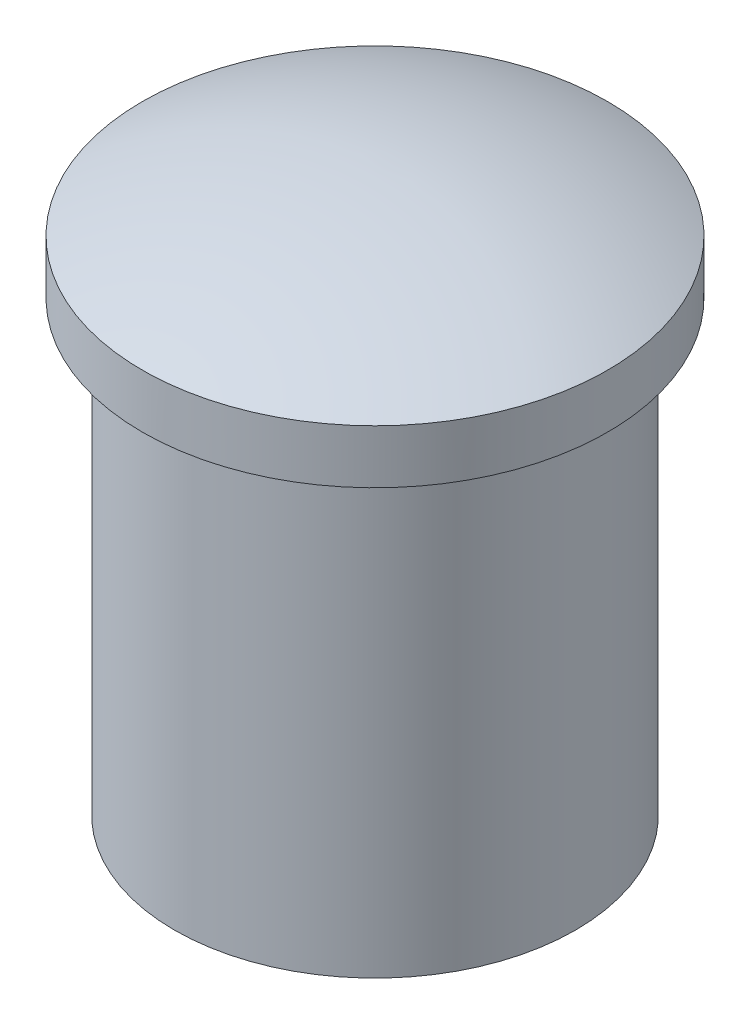
from build123d import *


with BuildPart() as part:
    # Sketch1 → Revolve1 (revolve)
    with BuildSketch(Plane.XY):
        with BuildLine():
            Line((-1.651, 0.381), (-1.651, 0))
            Line((-1.651, 0), (-1.4224, 0))
            Line((-1.4224, 0), (-1.4224, -3.175))
            ThreePointArc((-1.4224, -3.175), (-0.739659165, -2.872192923), (0, -2.7686))
            Line((0, -2.7686), (0, 0.762))
            ThreePointArc((0, 0.762), (-0.847195668, 0.665514562), (-1.651, 0.381))
        make_face()
    revolve(axis=Axis((0, -2.7686, 0), (0, 1, 0)))


solid = part.part
